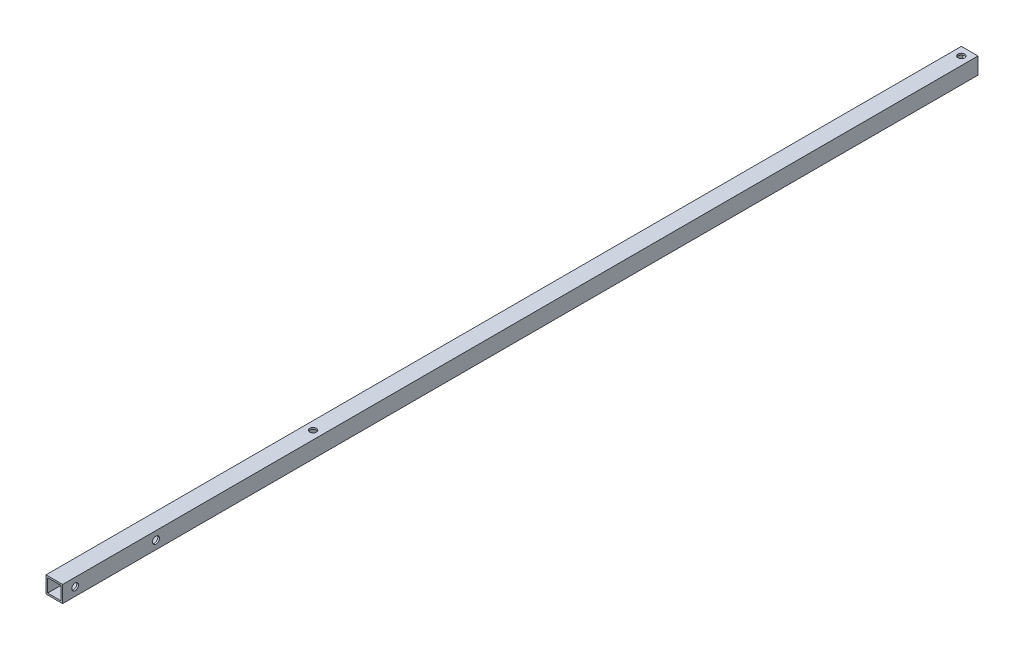
from build123d import *

# Parameters (mm, degrees)
SKETCH_1_W          = 10
SKETCH_1_H          = 10
SKETCH_1_W_2        = 8
SKETCH_1_H_2        = 8
EXTRUDE_1_DEPTH     = 550
SKETCH_2_R          = 2
CUT_EXTRUDE_1_DEPTH = 551.113624627
SKETCH_3_R          = 2.1
CUT_EXTRUDE_2_DEPTH = 551.113624627
SKETCH_4_R          = 2
CUT_EXTRUDE_3_DEPTH = 551.113624627


with BuildPart() as part:
    # ｽｹｯﾁ1 → 押し出し-薄板1 (new body)
    with BuildSketch(Plane.XY):
        Rectangle(SKETCH_1_W, SKETCH_1_H)
        Rectangle(SKETCH_1_W_2, SKETCH_1_H_2, mode=Mode.SUBTRACT)
    extrude(amount=EXTRUDE_1_DEPTH)

    # ｽｹｯﾁ2 → ｶｯﾄ - 押し出し1 (cut, through all)
    with BuildSketch(Plane(origin=(0, 5, 0), x_dir=(1, 0, 0), z_dir=(0, 1, 0))):
        with Locations(Location((0, -5, 0), (0, 0, 270))):
            Circle(SKETCH_2_R)
        with Locations(Location((0, -394.5, 0), (0, 0, 270))):
            Circle(SKETCH_2_R)
    extrude(amount=-CUT_EXTRUDE_1_DEPTH, mode=Mode.SUBTRACT)

    # ｽｹｯﾁ3 → ｶｯﾄ - 押し出し2 (cut, through all)
    with BuildSketch(Plane(origin=(5, 0, 0), x_dir=(0, 0, -1), z_dir=(1, 0, 0))):
        with Locations((-493.91, 0)):
            Circle(SKETCH_3_R)
    extrude(amount=-CUT_EXTRUDE_2_DEPTH, mode=Mode.SUBTRACT)

    # ｽｹｯﾁ4 → ｶｯﾄ - 押し出し3 (cut, through all)
    with BuildSketch(Plane(origin=(5, 0, 0), x_dir=(0, 0, -1), z_dir=(1, 0, 0))):
        with Locations((-542.5, 0)):
            Circle(SKETCH_4_R)
    extrude(amount=-CUT_EXTRUDE_3_DEPTH, mode=Mode.SUBTRACT)


solid = part.part
